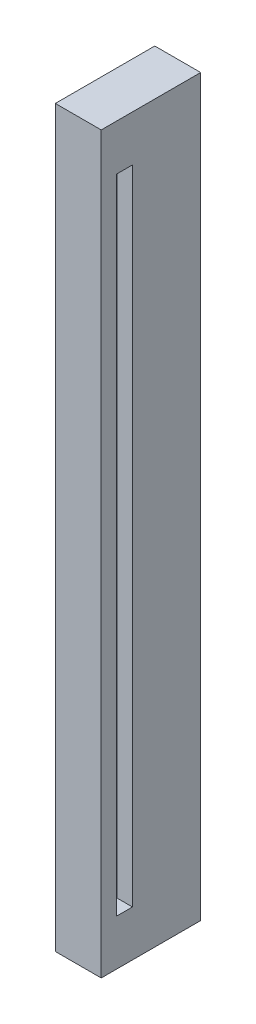
from build123d import *

# Parameters (mm, degrees)
SKETCH1_W           = 19.05
SKETCH1_H           = 304.8
BOSS_EXTRUDE1_DEPTH = 41.275
SKETCH2_W           = 6.604
SKETCH2_H           = 266.7
CUT_EXTRUDE1_DEPTH  = 6.35


with BuildPart() as part:
    # Sketch1 → Boss-Extrude1 (new body)
    with BuildSketch(Plane.XY):
        Rectangle(SKETCH1_W, SKETCH1_H)
    extrude(amount=BOSS_EXTRUDE1_DEPTH)

    # Sketch2 → Cut-Extrude1 (cut)
    with BuildSketch(Plane(origin=(9.525, 0, 0), x_dir=(0, 0, -1), z_dir=(1, 0, 0))):
        with Locations((-31.623, 0)):
            Rectangle(SKETCH2_W, SKETCH2_H)
    extrude(amount=-CUT_EXTRUDE1_DEPTH, mode=Mode.SUBTRACT)


solid = part.part
